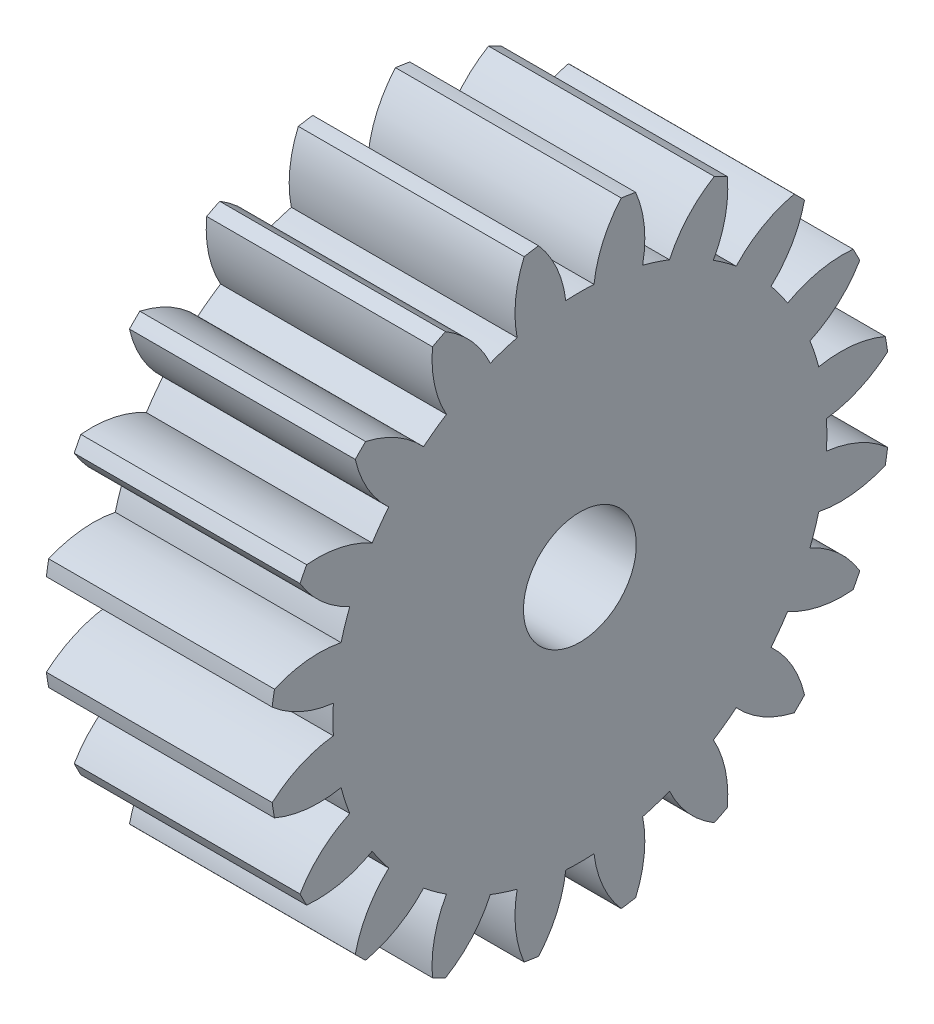
from build123d import *

# Parameters (mm, degrees)
BASPROSKE_W     = 8
BASPROSKE_H     = 11
TOOTHCUT_DEPTH  = 18.492855685
TEETHCUTS_COUNT = 20
TEETHCUTS_ANGLE = 342
BORSKE_R        = 2
BORE_DEPTH      = 50.0000508


with BuildPart() as part:
    # BasProSke → Base-Revolve (revolve)
    with BuildSketch(Plane(origin=(0, 0, 0), x_dir=(1, 0, 0), z_dir=(0, 1, 0)), mode=Mode.PRIVATE) as base_revolve_sk:
        with Locations((4, 5.5)):
            Rectangle(BASPROSKE_W, BASPROSKE_H)
    revolve(base_revolve_sk.sketch.rotate(Axis((-10, 0, 0), (1, 0, 0)), 180), axis=Axis((-10, 0, 0), (1, 0, 0)))

    # TooCutSke → ToothCut (cut, through all)
    with BuildSketch(Plane(origin=(0, 0, 0), x_dir=(0, 0, -1), z_dir=(1, 0, 0))):
        with BuildLine():
            ThreePointArc((0.499924007, 8.734705318), (0, 8.749), (-0.499924007, 8.734705318))
            ThreePointArc((-0.499924007, 8.734705318), (-0.824302243, 9.905497836), (-1.485192705, 10.924909509))
            ThreePointArc((-1.485192705, 10.924909509), (0, 11.0254), (1.485192705, 10.924909509))
            ThreePointArc((1.485192705, 10.924909509), (0.824302243, 9.905497836), (0.499924007, 8.734705318))
        make_face()
    toothcut = extrude(amount=TOOTHCUT_DEPTH, mode=Mode.SUBTRACT)

    # TeethCuts: ToothCut ×20 about axis
    teethcuts_axis = Axis((-10, 0, 0), (1, 0, 0))
    for i in range(1, TEETHCUTS_COUNT):
        add(toothcut.rotate(teethcuts_axis, i * TEETHCUTS_ANGLE / (TEETHCUTS_COUNT - 1)), mode=Mode.SUBTRACT)

    # BorSke → Bore (cut, symmetric)
    with BuildSketch(Plane(origin=(0, 0, 0), x_dir=(0, 0, -1), z_dir=(1, 0, 0))):
        with Locations(Location((0, 0, 0), (0, 0, 180))):
            Circle(BORSKE_R)
    extrude(amount=BORE_DEPTH, both=True, mode=Mode.SUBTRACT)


solid = part.part
